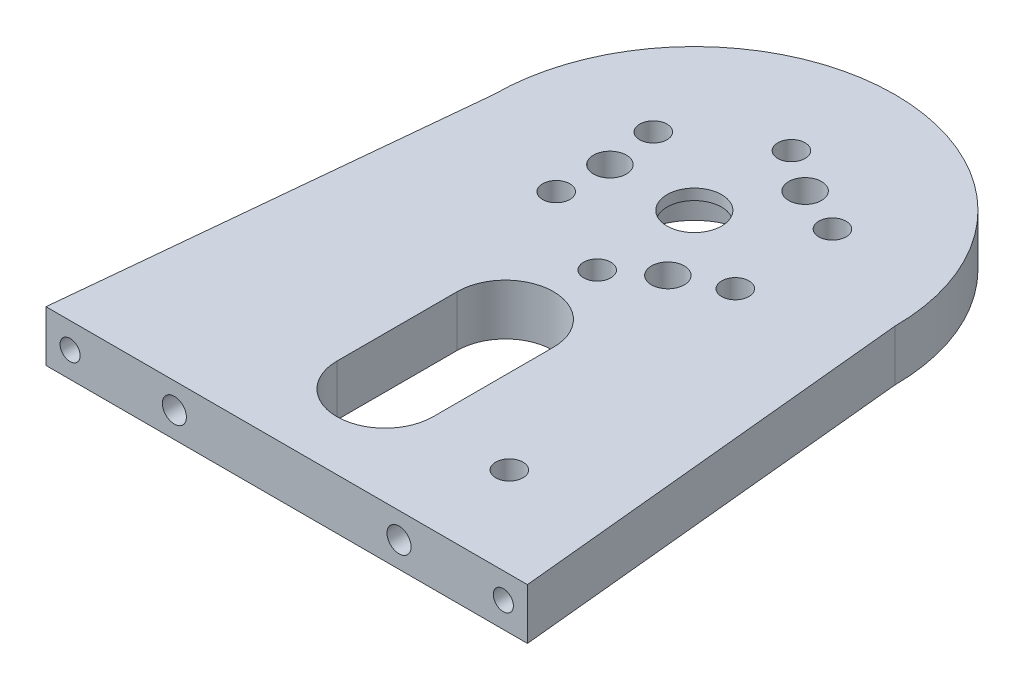
from build123d import *

# Parameters (mm, degrees)
PLACA_ANTEBRAZO_START          = -3.175
PLACA_ANTEBRAZO_DEPTH          = 6.35
PLACA_ANTEBRAZO_REDONDEO_START = -3.175
CROQUIS13_R                    = 25
PLACA_ANTEBRAZO_REDONDEO_DEPTH = 6.35
BARRENOS_J3_START              = -3.175
CROQUIS14_R                    = 1.7
CROQUIS14_R_2                  = 2.05
CROQUIS14_R_3                  = 3.4
BARRENOS_J3_DEPTH              = 6.35
REFRENTADOS_J3_START           = -3.175
CROQUIS15_R                    = 3
REFRENTADOS_J3_DEPTH           = 3.2
ALIGERADO_PASO_CABLE_START     = -3.175
ALIGERADO_PASO_CABLE_DEPTH     = 6.35
ROSCA_M3_CANTO_START           = 213.25
CROQUIS17_R                    = 1.25
ROSCA_M3_CANTO_DEPTH           = 9
PASADORES_D3_START             = 215.25
CROQUIS18_R                    = 1.5
PASADORES_D3_DEPTH             = 7
PASO_M3_BASES_CINCHO_START     = -3.175
CROQUIS20_R                    = 1.7
PASO_M3_BASES_CINCHO_DEPTH     = 6.35
CROQUIS21_R                    = 7.45
CORTAR_EXTRUIR1_DEPTH          = 5


with BuildPart() as part:
    # Croquis12 → Placa_antebrazo (new body)
    with BuildSketch(Plane(origin=(0, 0, 0), x_dir=(1, 0, 0), z_dir=(0, 1, 0)).offset(PLACA_ANTEBRAZO_START)):
        Polygon((127.4, -171.45), (177.4, -171.45), (182.4, -222.25), (122.4, -222.25), align=None)
    extrude(amount=PLACA_ANTEBRAZO_DEPTH)

    # Croquis13 → Placa_antebrazo_redondeo (add)
    with BuildSketch(Plane(origin=(0, 0, 0), x_dir=(1, 0, 0), z_dir=(0, 1, 0)).offset(PLACA_ANTEBRAZO_REDONDEO_START)):
        with Locations((152.4, -171.45)):
            Circle(CROQUIS13_R)
    extrude(amount=PLACA_ANTEBRAZO_REDONDEO_DEPTH)

    # Croquis14 → Barrenos_J3 (cut)
    with BuildSketch(Plane(origin=(0, 0, 0), x_dir=(1, 0, 0), z_dir=(0, 1, 0)).offset(BARRENOS_J3_START)):
        with Locations((163.416293151, -177.356884561)):
            Circle(CROQUIS14_R)
        with Locations((152.792634488, -183.943832005)):
            Circle(CROQUIS14_R)
        with Locations((141.776341338, -178.036947444)):
            Circle(CROQUIS14_R)
        with Locations((141.383706849, -165.543115439)):
            Circle(CROQUIS14_R)
        with Locations((152.007365512, -158.956167995)):
            Circle(CROQUIS14_R)
        with Locations((163.023658662, -164.863052556)):
            Circle(CROQUIS14_R)
        with Locations((157.774949114, -180.118905468)):
            Circle(CROQUIS14_R_2)
        with Locations((142.205033084, -171.770389743)):
            Circle(CROQUIS14_R_2)
        with Locations((157.220017802, -162.460704789)):
            Circle(CROQUIS14_R_2)
        with Locations((152.4, -171.45)):
            Circle(CROQUIS14_R_3)
    extrude(amount=BARRENOS_J3_DEPTH, mode=Mode.SUBTRACT)

    # Croquis15 → Refrentados_J3 (cut)
    with BuildSketch(Plane(origin=(0, 0, 0), x_dir=(1, 0, 0), z_dir=(0, 1, 0)).offset(REFRENTADOS_J3_START)):
        with Locations((163.416293151, -177.356884561)):
            Circle(CROQUIS15_R)
        with Locations((152.792634488, -183.943832005)):
            Circle(CROQUIS15_R)
        with Locations((141.776341338, -178.036947444)):
            Circle(CROQUIS15_R)
        with Locations((141.383706849, -165.543115439)):
            Circle(CROQUIS15_R)
        with Locations((152.007365512, -158.956167995)):
            Circle(CROQUIS15_R)
        with Locations((163.023658662, -164.863052556)):
            Circle(CROQUIS15_R)
    extrude(amount=REFRENTADOS_J3_DEPTH, mode=Mode.SUBTRACT)

    # Croquis16 → Aligerado_paso_cable (cut)
    with BuildSketch(Plane(origin=(0, 0, 0), x_dir=(1, 0, 0), z_dir=(0, 1, 0)).offset(ALIGERADO_PASO_CABLE_START)):
        with BuildLine():
            Line((158.4, -195), (158.4, -210))
            ThreePointArc((158.4, -210), (152.4, -216), (146.4, -210))
            Line((146.4, -210), (146.4, -195))
            ThreePointArc((146.4, -195), (152.4, -189), (158.4, -195))
        make_face()
    extrude(amount=ALIGERADO_PASO_CABLE_DEPTH, mode=Mode.SUBTRACT)

    # Croquis17 → Rosca_M3_canto (cut)
    with BuildSketch(Plane.XY.offset(ROSCA_M3_CANTO_START)):
        with Locations((125.4, 0)):
            Circle(CROQUIS17_R)
        with Locations((179.4, 0)):
            Circle(CROQUIS17_R)
    extrude(amount=ROSCA_M3_CANTO_DEPTH, mode=Mode.SUBTRACT)

    # Croquis18 → Pasadores_D3 (cut)
    with BuildSketch(Plane.XY.offset(PASADORES_D3_START)):
        with Locations((138.4, 0)):
            Circle(CROQUIS18_R)
        with Locations((166.4, 0)):
            Circle(CROQUIS18_R)
    extrude(amount=PASADORES_D3_DEPTH, mode=Mode.SUBTRACT)

    # Croquis20 → Paso_M3_bases_cincho (cut)
    with BuildSketch(Plane(origin=(0, 0, 0), x_dir=(1, 0, 0), z_dir=(0, 1, 0)).offset(PASO_M3_BASES_CINCHO_START)):
        with Locations((168.9, -211)):
            Circle(CROQUIS20_R)
    extrude(amount=PASO_M3_BASES_CINCHO_DEPTH, mode=Mode.SUBTRACT)

    # Croquis21 → Cortar-Extruir1 (cut)
    with BuildSketch(Plane.XZ.offset(3.175)):
        with Locations((152.4, 171.45)):
            Circle(CROQUIS21_R)
    extrude(amount=-CORTAR_EXTRUIR1_DEPTH, mode=Mode.SUBTRACT)


solid = part.part
